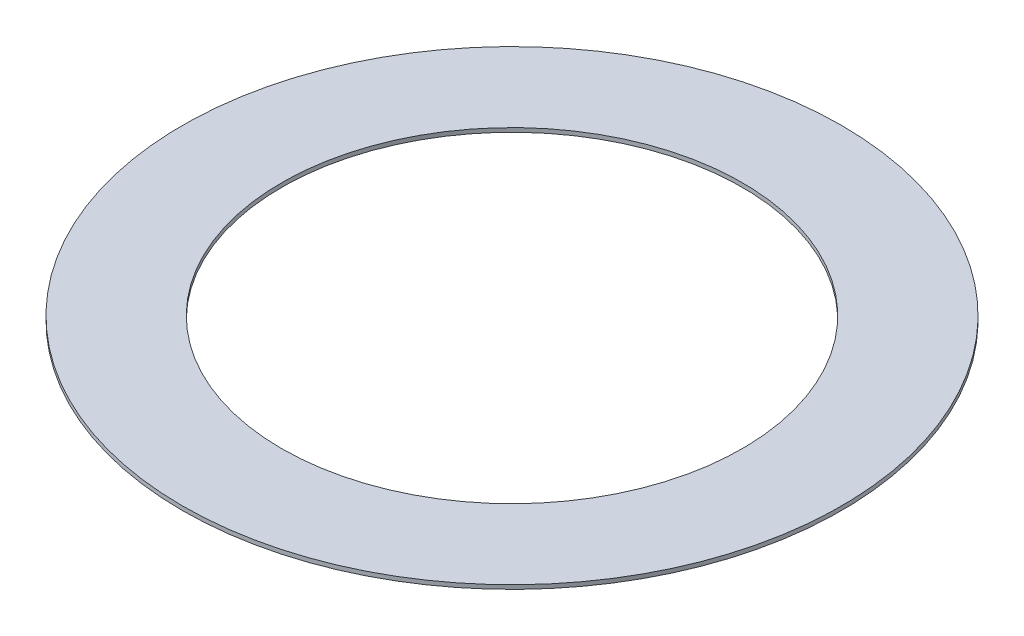
from build123d import *

# Parameters (mm, degrees)
SKETCH1_R           = 243.07243807
SKETCH1_R_2         = 169.891157402
BOSS_EXTRUDE1_DEPTH = 3


with BuildPart() as part:
    # Sketch1 → Boss-Extrude1 (new body)
    with BuildSketch(Plane(origin=(0, 0, 0), x_dir=(1, 0, 0), z_dir=(0, 1, 0))):
        with Locations(Location((0, 0, 0), (0, 0, 270))):
            Circle(SKETCH1_R)
        with Locations(Location((0, 0, 0), (0, 0, 270))):
            Circle(SKETCH1_R_2, mode=Mode.SUBTRACT)
    extrude(amount=BOSS_EXTRUDE1_DEPTH)


solid = part.part
